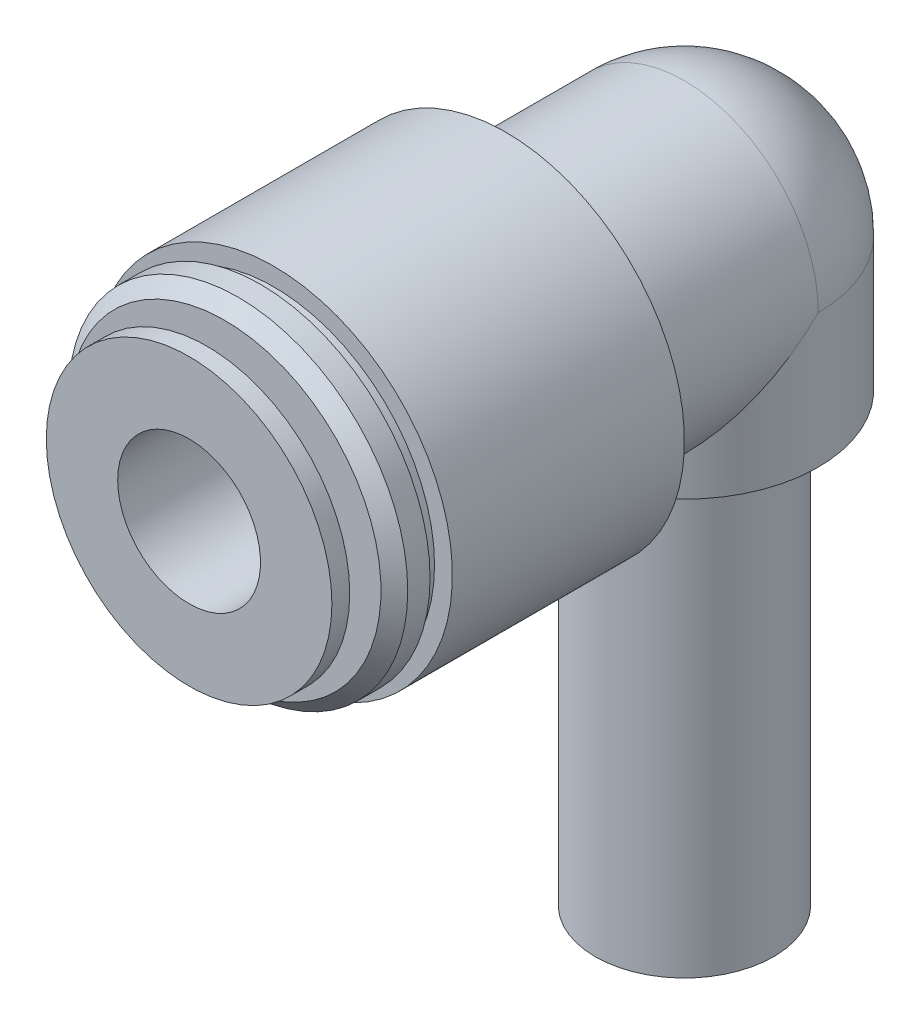
from build123d import *
from build123d.topology import SkipClean

# Parameters (mm, degrees)
SKETCH_1_R          = 5
SKETCH_1_R_2        = 4
EXTRUDE_1_DEPTH     = 25
SKETCH_3_R          = 7.5
EXTRUDE_2_DEPTH     = 10
SKETCH_4_R          = 10
EXTRUDE_3_DEPTH     = 13
SKETCH_6_R          = 4
CUT_EXTRUDE_1_DEPTH = 28


with BuildPart() as part:
    # Эскиз1 → Бобышка-Вытянуть1 (new body)
    with BuildSketch(Plane(origin=(0, 0, 0), x_dir=(1, 0, 0), z_dir=(0, 1, 0))):
        with Locations(Location((0, 0, 0), (0, 0, 270))):
            Circle(SKETCH_1_R)
        with Locations(Location((0, 0, 0), (0, 0, 270))):
            Circle(SKETCH_1_R_2, mode=Mode.SUBTRACT)
    extrude(amount=EXTRUDE_1_DEPTH)

    # Эскиз2 → Повернуть1 (revolve)
    with BuildSketch(Plane.XY, mode=Mode.PRIVATE) as revolve_1_sk:
        with BuildLine():
            Line((0, 25), (0, 40))
            ThreePointArc((0, 40), (5.303300859, 37.803300859), (7.5, 32.5))
            Line((7.5, 32.5), (7.5, 25))
            Line((7.5, 25), (0, 25))
        make_face()
    revolve(revolve_1_sk.sketch.rotate(Axis((0, 25, 0), (0, 1, 0)), 90), axis=Axis((0, 25, 0), (0, 1, 0)))

    # Эскиз3 → Бобышка-Вытянуть2 (add)
    with SkipClean():  # the faces are left unmerged after this step: merging them gives an invalid solid
        with BuildSketch(Plane.XY):
            with Locations((0, 32.5)):
                Circle(SKETCH_3_R)
        extrude(amount=EXTRUDE_2_DEPTH)

    # Эскиз4 → Бобышка-Вытянуть3 (add)
    with SkipClean():  # the faces are left unmerged after this step: merging them gives an invalid solid
        with BuildSketch(Plane.XY.offset(10)):
            with Locations(Location((0, 32.5, 0), (0, 0, 180))):
                Circle(SKETCH_4_R)
        extrude(amount=EXTRUDE_3_DEPTH)

    # Эскиз5 → Повернуть3 (revolve)
    with SkipClean():  # the faces are left unmerged after this step: merging them gives an invalid solid
        with BuildSketch(Plane(origin=(0, 0, 0), x_dir=(0, 0, -1), z_dir=(1, 0, 0)), mode=Mode.PRIVATE) as revolve_3_sk:
            Polygon((-26.75, 24.5), (-26.75, 26.5), (-25.75, 26.5), (-25.75, 23.75), (-25, 23), (-23.75, 23), (-23.75, 23.5), (-23, 23.5), (-23, 28.5), (-27.75, 28.5), (-27.75, 24.5), align=None)
        revolve(revolve_3_sk.sketch.rotate(Axis((0, 32.5, 23), (0, 0, 1)), 270), axis=Axis((0, 32.5, 23), (0, 0, 1)))

    # Эскиз6 → Вырез-Вытянуть1 (cut)
    with SkipClean():  # the faces are left unmerged after this step: merging them gives an invalid solid
        with BuildSketch(Plane.XY.offset(27.75)):
            with Locations(Location((0, 32.5, 0), (0, 0, 180))):
                Circle(SKETCH_6_R)
        extrude(amount=-CUT_EXTRUDE_1_DEPTH, mode=Mode.SUBTRACT)


solid = part.part
